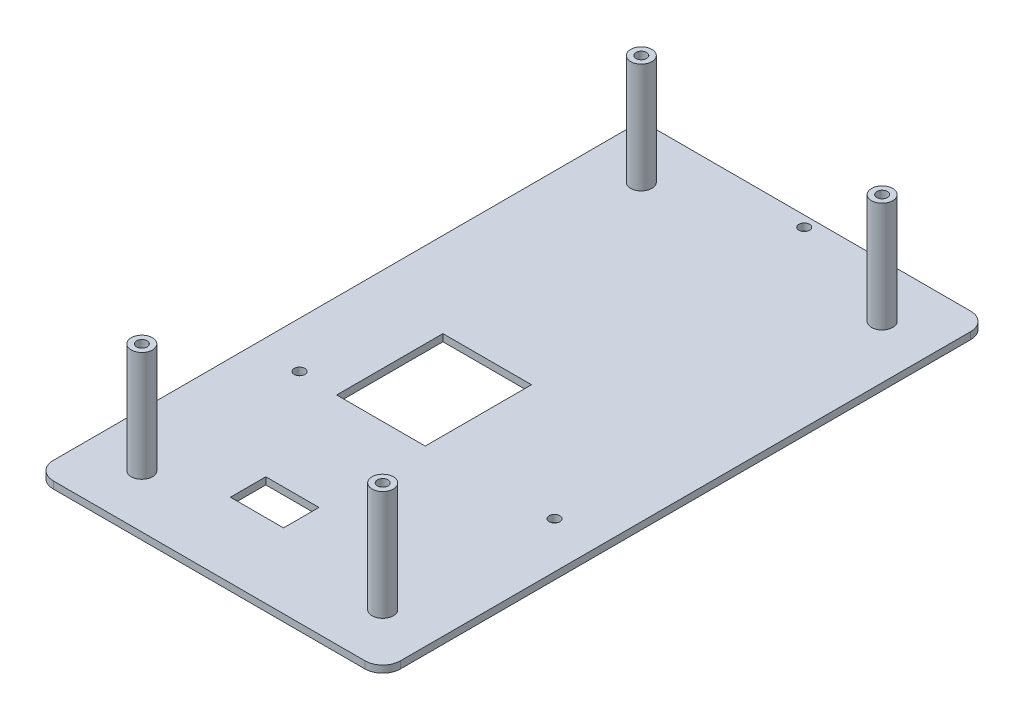
from build123d import *

# Parameters (mm, degrees)
CROQUIS1_W              = 98
CROQUIS1_H              = 171
CROQUIS1_W_2            = 15
CROQUIS1_H_2            = 10
SALIENTE_EXTRUIR1_DEPTH = 2
REDONDEO1_R             = 5
CROQUIS2_R              = 1.5
CORTAR_EXTRUIR2_DEPTH   = 10
CROQUIS5_R              = 3
SALIENTE_EXTRUIR2_DEPTH = 31
CROQUIS6_R              = 1.5
CORTAR_EXTRUIR3_DEPTH   = 15


with BuildPart() as part:
    # Croquis1 → Saliente-Extruir1 (new body)
    with BuildSketch(Plane(origin=(0, 0, 0), x_dir=(1, 0, 0), z_dir=(0, 1, 0))):
        Rectangle(CROQUIS1_W, CROQUIS1_H)
        with Locations((-7.5, -59.5)):
            Rectangle(CROQUIS1_W_2, CROQUIS1_H_2, mode=Mode.SUBTRACT)
        Polygon((-25, 5.5), (0, 5.5), (0, 0), (0, -24.5), (-25, -24.5), align=None, mode=Mode.SUBTRACT)
    extrude(amount=SALIENTE_EXTRUIR1_DEPTH)

    # Redondeo1
    redondeo1_edges = [part.edges().sort_by_distance(p)[0] for p in [
        (49, 1, 85.5),
        (-49, 1, 85.5),
        (-49, 1, -85.5),
        (49, 1, -85.5),
    ]]
    fillet(redondeo1_edges, radius=REDONDEO1_R)

    # Croquis2 → Cortar-Extruir2 (cut)
    with BuildSketch(Plane(origin=(0, 2, 0), x_dir=(1, 0, 0), z_dir=(0, 1, 0))):
        with Locations(Location((-36, -24, 0), (0, 0, 270))):
            Circle(CROQUIS2_R)
        with Locations(Location((36, -24, 0), (0, 0, 270))):
            Circle(CROQUIS2_R)
        with Locations(Location((0, 82.5, 0), (0, 0, 270))):
            Circle(CROQUIS2_R)
    extrude(amount=-CORTAR_EXTRUIR2_DEPTH, mode=Mode.SUBTRACT)

    # Croquis5 → Saliente-Extruir2 (add)
    with BuildSketch(Plane(origin=(0, 2, 0), x_dir=(1, 0, 0), z_dir=(0, 1, 0))):
        with Locations(Location((-34, 70.5, 0), (0, 0, 270))):
            Circle(CROQUIS5_R)
        with Locations(Location((34, 70.5, 0), (0, 0, 90))):
            Circle(CROQUIS5_R)
        with Locations(Location((34, -70.5, 0), (0, 0, 270))):
            Circle(CROQUIS5_R)
        with Locations(Location((-34, -70.5, 0), (0, 0, 90))):
            Circle(CROQUIS5_R)
    extrude(amount=SALIENTE_EXTRUIR2_DEPTH)

    # Croquis6 → Cortar-Extruir3 (cut)
    with BuildSketch(Plane(origin=(0, 33, 0), x_dir=(1, 0, 0), z_dir=(0, 1, 0))):
        with Locations(Location((-34, 70.5, 0), (0, 0, 270))):
            Circle(CROQUIS6_R)
        with Locations(Location((34, 70.5, 0), (0, 0, 270))):
            Circle(CROQUIS6_R)
        with Locations(Location((34, -70.5, 0), (0, 0, 270))):
            Circle(CROQUIS6_R)
        with Locations(Location((-34, -70.5, 0), (0, 0, 270))):
            Circle(CROQUIS6_R)
    extrude(amount=-CORTAR_EXTRUIR3_DEPTH, mode=Mode.SUBTRACT)


solid = part.part
